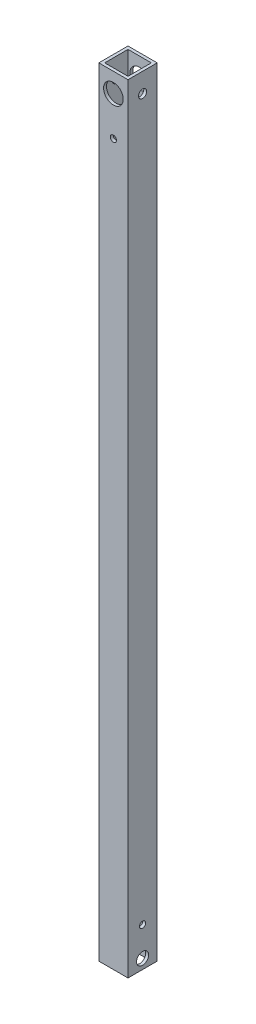
from build123d import *

# Parameters (mm, degrees)
SKETCH_1_W          = 15
SKETCH_1_H          = 15
SKETCH_1_W_2        = 12
SKETCH_1_H_2        = 12
EXTRUDE_1_DEPTH     = 400
SKETCH_2_R          = 5.05
SKETCH_2_R_2        = 1.6
CUT_EXTRUDE_1_DEPTH = 401.35140814
SKETCH_3_R          = 2.1
CUT_EXTRUDE_2_DEPTH = 401.35140814
SKETCH_4_R          = 3.1
CUT_EXTRUDE_3_DEPTH = 401.35140814
SKETCH_5_R          = 3.1
SKETCH_5_R_2        = 1.6
CUT_EXTRUDE_4_DEPTH = 401.35140814


with BuildPart() as part:
    # ｽｹｯﾁ1 → 押し出し-薄板1 (new body)
    with BuildSketch(Plane(origin=(0, 0, 0), x_dir=(1, 0, 0), z_dir=(0, 1, 0))):
        Rectangle(SKETCH_1_W, SKETCH_1_H)
        Rectangle(SKETCH_1_W_2, SKETCH_1_H_2, mode=Mode.SUBTRACT)
    extrude(amount=EXTRUDE_1_DEPTH)

    # ｽｹｯﾁ2 → ｶｯﾄ - 押し出し1 (cut, through all)
    with BuildSketch(Plane.XY.offset(7.5)):
        with Locations((0, 390)):
            Circle(SKETCH_2_R)
        with Locations((0, 370)):
            Circle(SKETCH_2_R_2)
    extrude(amount=-CUT_EXTRUDE_1_DEPTH, mode=Mode.SUBTRACT)

    # ｽｹｯﾁ3 → ｶｯﾄ - 押し出し2 (cut, through all)
    with BuildSketch(Plane(origin=(7.5, 0, 0), x_dir=(0, 0, -1), z_dir=(1, 0, 0))):
        with Locations((0, 390)):
            Circle(SKETCH_3_R)
    extrude(amount=-CUT_EXTRUDE_2_DEPTH, mode=Mode.SUBTRACT)

    # ｽｹｯﾁ4 → ｶｯﾄ - 押し出し3 (cut, through all)
    with BuildSketch(Plane(origin=(7.5, 0, 0), x_dir=(0, 0, -1), z_dir=(1, 0, 0))):
        with Locations((0, 5)):
            Circle(SKETCH_4_R)
    extrude(amount=-CUT_EXTRUDE_3_DEPTH, mode=Mode.SUBTRACT)

    # ｽｹｯﾁ5 → ｶｯﾄ - 押し出し4 (cut, through all)
    with BuildSketch(Plane(origin=(7.5, 0, 0), x_dir=(0, 0, -1), z_dir=(1, 0, 0))):
        with Locations((0, 5)):
            Circle(SKETCH_5_R)
        with Locations((0, 20)):
            Circle(SKETCH_5_R_2)
    extrude(amount=-CUT_EXTRUDE_4_DEPTH, mode=Mode.SUBTRACT)


solid = part.part
